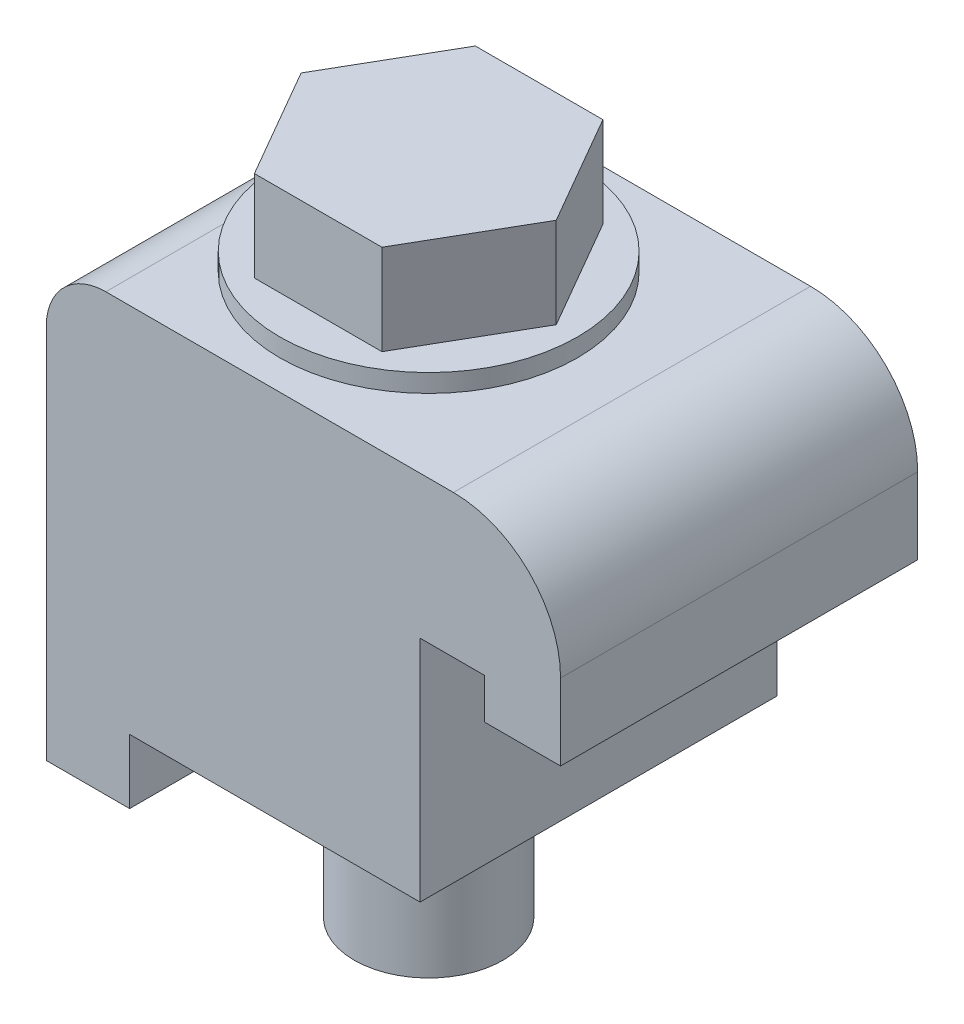
from build123d import *

# Parameters (mm, degrees)
BOSS_EXTRUDE1_DEPTH      = 9.525
BOSS_EXTRUDE1_DEPTH_BACK = 9.525
SKETCH2_W                = 4.445
SKETCH2_H                = 3.429
BOSS_EXTRUDE2_DEPTH      = 19.05
SKETCH3_R                = 4.5212
CUT_EXTRUDE1_DEPTH       = 167.397459987
SKETCH7_R                = 7.9375
SKETCH7_R_2              = 4.2291
BOSS_EXTRUDE3_DEPTH      = 0.9652
SKETCH8_R                = 3.96875
BOSS_EXTRUDE4_DEPTH      = 30.777
BOSS_EXTRUDE5_DEPTH      = 4.826


with BuildPart() as part:
    # Sketch1 → Boss-Extrude1 (new, two sides: drawn at the far end of the back side and taken through both)
    with BuildSketch(Plane.XY.offset(-BOSS_EXTRUDE1_DEPTH_BACK)):
        with BuildLine():
            Line((-164.939, 1.96699994), (-145, 1.96699994))
            Line((-145, 1.96699994), (-145, 14.15899994))
            Line((-145, 14.15899994), (-141.571, 14.15899994))
            Line((-141.571, 14.15899994), (-141.571, 11.99999994))
            Line((-141.571, 11.99999994), (-137.507, 11.99999994))
            Line((-137.507, 11.99999994), (-137.507, 16.06399994))
            ThreePointArc((-137.507, 16.06399994), (-139.180884746, 20.105115194), (-143.222, 21.77899994))
            Line((-143.222, 21.77899994), (-161.764, 21.77899994))
            ThreePointArc((-161.764, 21.77899994), (-164.00906403, 20.84906397), (-164.939, 18.60399994))
            Line((-164.939, 18.60399994), (-164.939, 1.96699994))
        make_face()
    extrude(amount=BOSS_EXTRUDE1_DEPTH + BOSS_EXTRUDE1_DEPTH_BACK)

    # Sketch2 → Boss-Extrude2 (add)
    with BuildSketch(Plane.XY.offset(9.525)):
        with Locations((-162.7165, 0.25249994)):
            Rectangle(SKETCH2_W, SKETCH2_H)
    extrude(amount=-BOSS_EXTRUDE2_DEPTH)

    # Sketch3 → Cut-Extrude1 (cut, through all)
    with BuildSketch(Plane.XZ.offset(-1.96699994)):
        with Locations(Location((-154.0678, 0, 0), (0, 0, 270))):
            Circle(SKETCH3_R)
    extrude(amount=-CUT_EXTRUDE1_DEPTH, mode=Mode.SUBTRACT)


with BuildPart() as body_2:
    # Sketch7 → Boss-Extrude3 (new body)
    with BuildSketch(Plane(origin=(0, 21.77899994, 0), x_dir=(1, 0, 0), z_dir=(0, 1, 0))):
        with Locations(Location((-154.0678, 0, 0), (0, 0, 90))):
            Circle(SKETCH7_R)
        with Locations(Location((-154.0678, 0, 0), (0, 0, 90))):
            Circle(SKETCH7_R_2, mode=Mode.SUBTRACT)
    extrude(amount=BOSS_EXTRUDE3_DEPTH)


with BuildPart() as body_3:
    # Sketch8 → Boss-Extrude4 (new body)
    with BuildSketch(Plane(origin=(0, 22.74419994, 0), x_dir=(1, 0, 0), z_dir=(0, 1, 0))):
        with Locations(Location((-154.0678, 0, 0), (0, 0, 270))):
            Circle(SKETCH8_R)
    extrude(amount=-BOSS_EXTRUDE4_DEPTH)


with BuildPart() as body_4:
    # Sketch9 → Boss-Extrude5 (new body)
    with BuildSketch(Plane(origin=(0, 22.74419994, 0), x_dir=(1, 0, 0), z_dir=(0, 1, 0))):
        Polygon((-150.665590334, 5.8928), (-157.470009666, 5.8928), (-160.872219333, 0), (-157.470009666, -5.8928), (-150.665590334, -5.8928), (-147.263380667, 0), align=None)
    extrude(amount=BOSS_EXTRUDE5_DEPTH)

    # Combine1: union body 3
    add(body_3.part)


solid = Compound([part.part, body_2.part, body_4.part])
